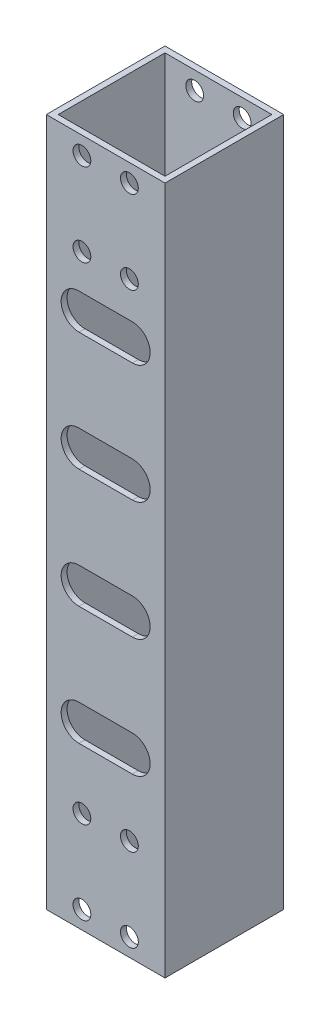
from build123d import *

# Parameters (mm, degrees)
SKETCH_1_W             = 20
SKETCH_1_H             = 20
SKETCH_1_W_2           = 18
SKETCH_1_H_2           = 18
HS_20X20X1_1_DEPTH     = 116
CUT_EXTRUDE_4_DEPTH    = 37
PATTERN_LINEAR_1_COUNT = 4
PATTERN_LINEAR_1_PITCH = 20
SKETCH_5_R             = 1.5
CUT_EXTRUDE_5_DEPTH    = 31


with BuildPart() as part:
    # 草图1 → Hs 20X20X1(1) (new body)
    with BuildSketch(Plane(origin=(0, 0, 0), x_dir=(1, 0, 0), z_dir=(0, 1, 0))):
        Rectangle(SKETCH_1_W, SKETCH_1_H)
        Rectangle(SKETCH_1_W_2, SKETCH_1_H_2, mode=Mode.SUBTRACT)
    extrude(amount=HS_20X20X1_1_DEPTH)

    # 草图4 → 切除-拉伸4 (cut)
    with BuildSketch(Plane(origin=(0, 0, -10), x_dir=(-1, 0, 0), z_dir=(0, 0, -1))):
        with BuildLine():
            Line((-4.5, 33), (4.5, 33))
            ThreePointArc((4.5, 33), (7.5, 30), (4.5, 27))
            Line((4.5, 27), (-4.5, 27))
            ThreePointArc((-4.5, 27), (-7.5, 30), (-4.5, 33))
        make_face()
    cut_extrude_4 = extrude(amount=-CUT_EXTRUDE_4_DEPTH, mode=Mode.SUBTRACT)

    # 阵列(线性)1: 切除-拉伸4 ×4
    with Locations(*[(0, i * PATTERN_LINEAR_1_PITCH, 0) for i in range(1, PATTERN_LINEAR_1_COUNT)]):
        add(cut_extrude_4, mode=Mode.SUBTRACT)

    # 草图5 → 切除-拉伸5 (cut)
    with BuildSketch(Plane(origin=(0, 0, -10), x_dir=(-1, 0, 0), z_dir=(0, 0, -1))):
        with Locations((-4, 3)):
            Circle(SKETCH_5_R)
        with Locations((4, 3)):
            Circle(SKETCH_5_R)
        with Locations((4, 17)):
            Circle(SKETCH_5_R)
        with Locations((-4, 17)):
            Circle(SKETCH_5_R)
        with Locations((-4, 113)):
            Circle(SKETCH_5_R)
        with Locations((4, 113)):
            Circle(SKETCH_5_R)
        with Locations((-4, 99)):
            Circle(SKETCH_5_R)
        with Locations((4, 99)):
            Circle(SKETCH_5_R)
    extrude(amount=-CUT_EXTRUDE_5_DEPTH, mode=Mode.SUBTRACT)


solid = part.part
